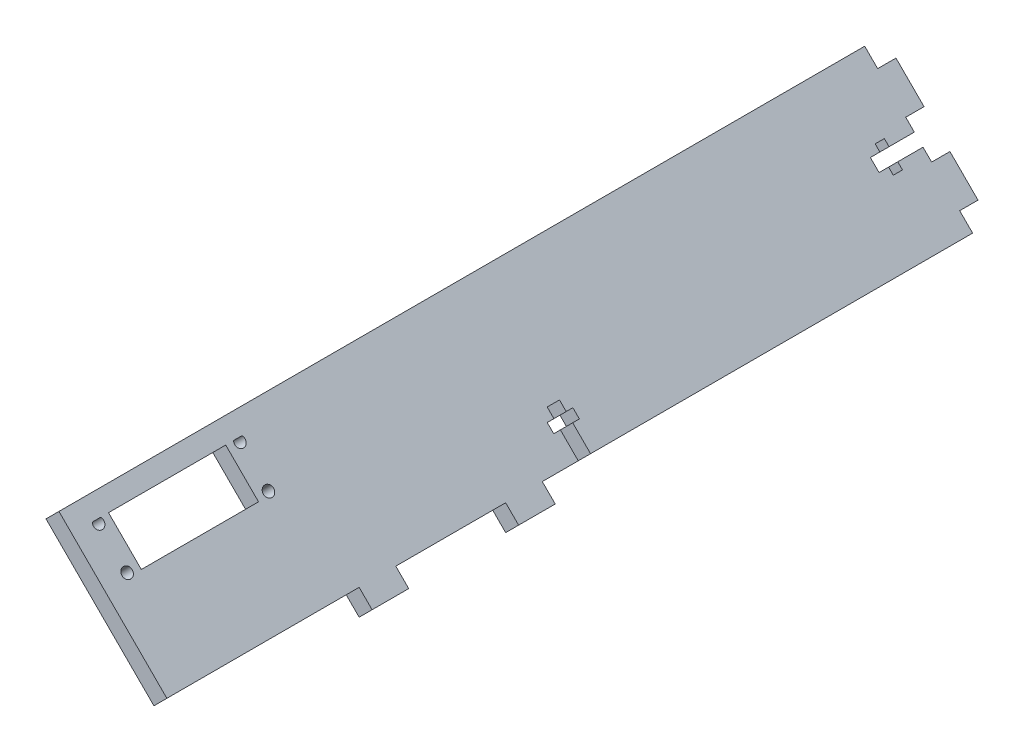
from build123d import *

# Parameters (mm, degrees)
BASE_EXTRUSION_DEPTH                     = 279.4
BASE_T_SLOT_DEPTH                        = 283.823092451
BASE_TABS_DEPTH                          = 6.35
SKETCH5_W                                = 40.64
SKETCH5_H                                = 20.066
SERVO_SLOT_DEPTH                         = 283.823092451
SKETCH6_R                                = 1.778
SERVO_MOUNTING_HOLES_DEPTH               = 283.823092451
FILLER_EXTRUSION_TO_FUNNEL_SUPPORT_DEPTH = 279.4
SIDE_T_SLOT_DEPTH                        = 284.874808603
SKETCH9_W                                = 6.35
SKETCH9_H                                = 12.7
SIDE_TABS_DEPTH                          = 6.35


with BuildPart() as part:
    # Sketch2 → Base Extrusion (new body)
    with BuildSketch(Plane.XY):
        Polygon((-71.1004567, -13.712301035), (-75.59058476, -18.202429096), (-47.146344636, -46.64666922), (-42.656216575, -42.15654116), align=None)
    extrude(amount=BASE_EXTRUSION_DEPTH)

    # Sketch3 → Base T Slot (cut, through all)
    with BuildSketch(Plane(origin=(-46.896506928, -46.896506928, 0), x_dir=(0, 0, 1), z_dir=(-0.7071067811865479, -0.7071067811865472, 0))):
        Polygon((0, 22.600038952), (0, 18.332838952), (8.763, 18.332838952), (8.763, 16.021438952), (11.938, 16.021438952), (11.938, 18.332838952), (15.24, 18.332838952), (15.24, 22.600038952), (11.938, 22.600038952), (11.938, 24.911438952), (8.763, 24.911438952), (8.763, 22.600038952), align=None)
    extrude(amount=-BASE_T_SLOT_DEPTH, mode=Mode.SUBTRACT)

    # Sketch4 → Base Tabs (add)
    with BuildSketch(Plane(origin=(0, 0, 0), x_dir=(-1, 0, 0), z_dir=(0, 0, -1))):
        Polygon((75.59058476, -18.202429096), (65.858592758, -27.934421097), (61.368464698, -23.444293037), (71.1004567, -13.712301035), align=None)
        Polygon((42.656216575, -42.15654116), (52.388208577, -32.424549158), (56.878336637, -36.914677218), (47.146344636, -46.64666922), align=None)
    extrude(amount=BASE_TABS_DEPTH)

    # Sketch5 → Servo Slot (cut, through all)
    with BuildSketch(Plane(origin=(-42.406378867, -42.406378867, 0), x_dir=(0, 0, -1), z_dir=(0.7071067811865476, 0.7071067811865476, 0))):
        with Locations((-246.38, 34.529271287)):
            Rectangle(SKETCH5_W, SKETCH5_H)
    extrude(amount=-SERVO_SLOT_DEPTH, mode=Mode.SUBTRACT)

    # Sketch6 → Servo Mounting Holes (cut, through all)
    with BuildSketch(Plane(origin=(-42.406378867, -42.406378867, 0), x_dir=(0, 0, -1), z_dir=(0.7071067811865476, 0.7071067811865476, 0))):
        with Locations((-270.88, 39.529271287)):
            Circle(SKETCH6_R)
        with Locations(Location((-270.88, 25.54655403, 0), (0, 0, 90))):
            Circle(SKETCH6_R)
        with Locations((-221.88, 39.529271287)):
            Circle(SKETCH6_R)
        with Locations(Location((-221.88, 25.54655403, 0), (0, 0, 90))):
            Circle(SKETCH6_R)
    extrude(amount=-SERVO_MOUNTING_HOLES_DEPTH, mode=Mode.SUBTRACT)

    # Sketch7 → Filler Extrusion to Funnel Support (add)
    with BuildSketch(Plane.XY.offset(279.4)):
        Polygon((-47.146344636, -46.64666922), (-42.656216575, -42.15654116), (-38.166088515, -46.64666922), (-42.656216575, -51.136797281), align=None)
        Polygon((-75.59058476, -18.202429096), (-71.1004567, -13.712301035), (-75.59058476, -9.222172974), (-80.080712821, -13.712301035), align=None)
    extrude(amount=-FILLER_EXTRUSION_TO_FUNNEL_SUPPORT_DEPTH)

    # Sketch8 → Side T Slot (cut, through all)
    with BuildSketch(Plane(origin=(-42.406378867, -42.406378867, 0), x_dir=(0.7071067811865477, -0.7071067811865474, 0), z_dir=(0.7071067811865474, 0.7071067811865477, 0))):
        Polygon((5.996676125, -136.7536), (5.996676125, -132.4864), (-2.766323875, -132.4864), (-2.766323875, -130.175), (-5.941323875, -130.175), (-5.941323875, -132.4864), (-9.243323875, -132.4864), (-9.243323875, -136.7536), (-5.941323875, -136.7536), (-5.941323875, -139.065), (-2.766323875, -139.065), (-2.766323875, -136.7536), align=None)
    extrude(amount=-SIDE_T_SLOT_DEPTH, mode=Mode.SUBTRACT)

    # Sketch9 → Side Tabs (add)
    with BuildSketch(Plane(origin=(4.240290353, -4.240290353, 0), x_dir=(-0.7071067811865475, -0.7071067811865477, 0), z_dir=(0.7071067811865477, -0.7071067811865475, 0))):
        with Locations((63.146676125, -206.375)):
            Rectangle(SKETCH9_W, SKETCH9_H)
        with Locations((63.146676125, -155.575)):
            Rectangle(SKETCH9_W, SKETCH9_H)
    extrude(amount=SIDE_TABS_DEPTH)


solid = part.part
